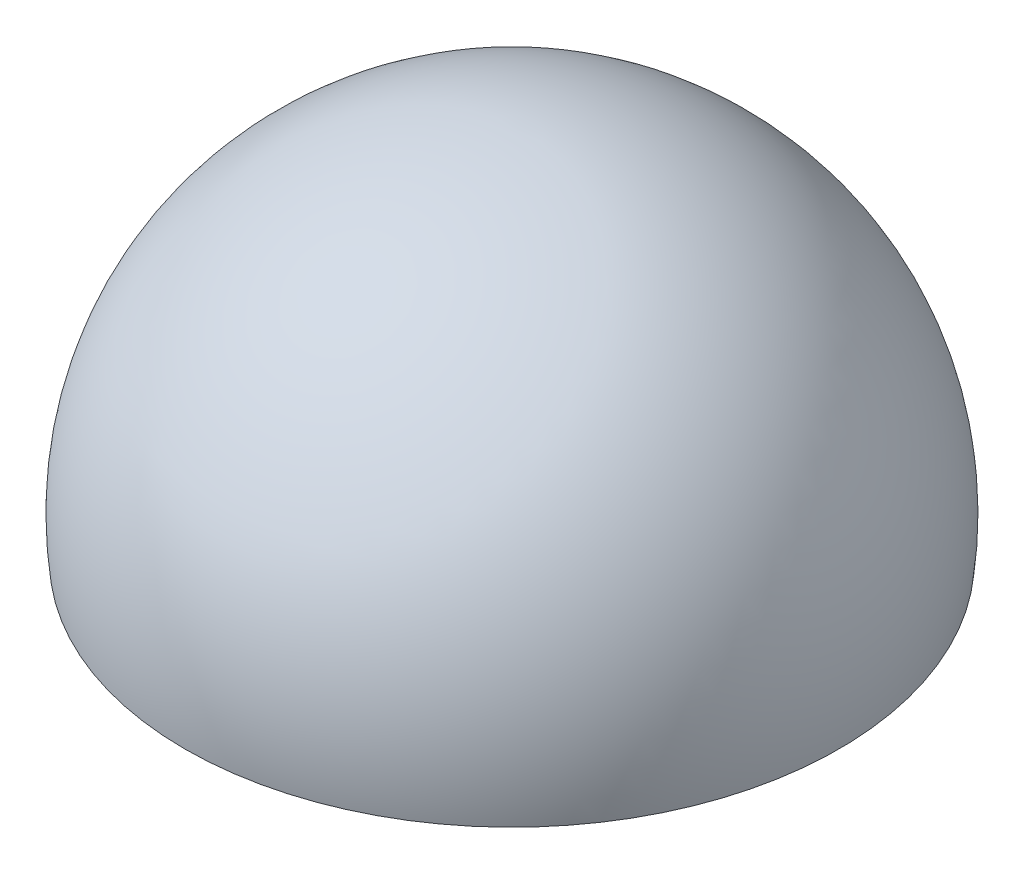
from build123d import *


with BuildPart() as part:
    # Sketch3 → Revolve1 (revolve)
    with BuildSketch(Plane(origin=(0, 0, 0), x_dir=(0, 0, -1), z_dir=(1, 0, 0))):
        with BuildLine():
            ThreePointArc((0, 8.5), (5.667892024, 5.942257669), (7.5, 0))
            Line((7.5, 0), (0, 0))
            Line((0, 0), (0, 8.5))
        make_face()
    revolve(axis=Axis((0, 0, 0), (0, 1, 0)))

    # Sketch4 → Cut-Revolve1 (revolve, cut)
    with BuildSketch(Plane(origin=(0, 0, 0), x_dir=(0, 0, -1), z_dir=(1, 0, 0)), mode=Mode.PRIVATE) as cut_revolve1_sk:
        with BuildLine():
            Line((2.55, 0), (2.55, 2))
            ThreePointArc((2.55, 2), (2.806354397, 5.280990742), (0, 7))
            Line((0, 7), (0, 0))
            Line((0, 0), (2.55, 0))
        make_face()
    revolve(cut_revolve1_sk.sketch.rotate(Axis((0, 0, 0), (0, -1, 0)), 180), axis=Axis((0, 0, 0), (0, -1, 0)), mode=Mode.SUBTRACT)


solid = part.part
